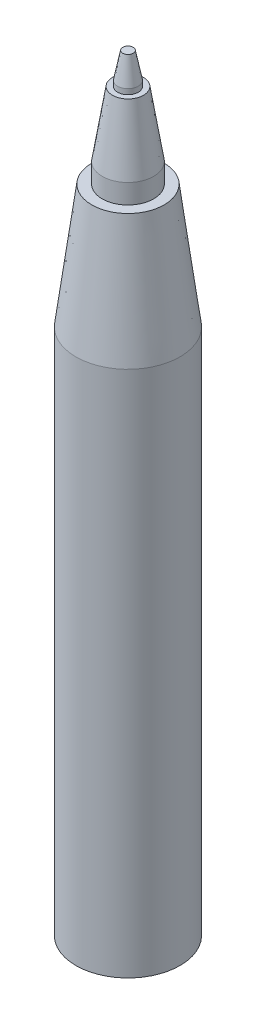
from build123d import *


with BuildPart() as part:
    # Sketch1 → Revolve1 (revolve)
    with BuildSketch(Plane.XY, mode=Mode.PRIVATE) as revolve1_sk:
        Polygon((0, 0), (4, 0), (4, 40.5), (2.778125, 50), (1.978125, 50), (1.978125, 51.5), (1.190625, 56.5), (0.790625, 56.5), (0.790625, 56.9), (0.4, 58.9), (0, 58.9), align=None)
    revolve(revolve1_sk.sketch.rotate(Axis((0, 0.839345578, 0), (0, -1, 0)), 90), axis=Axis((0, 0.839345578, 0), (0, -1, 0)))


solid = part.part
